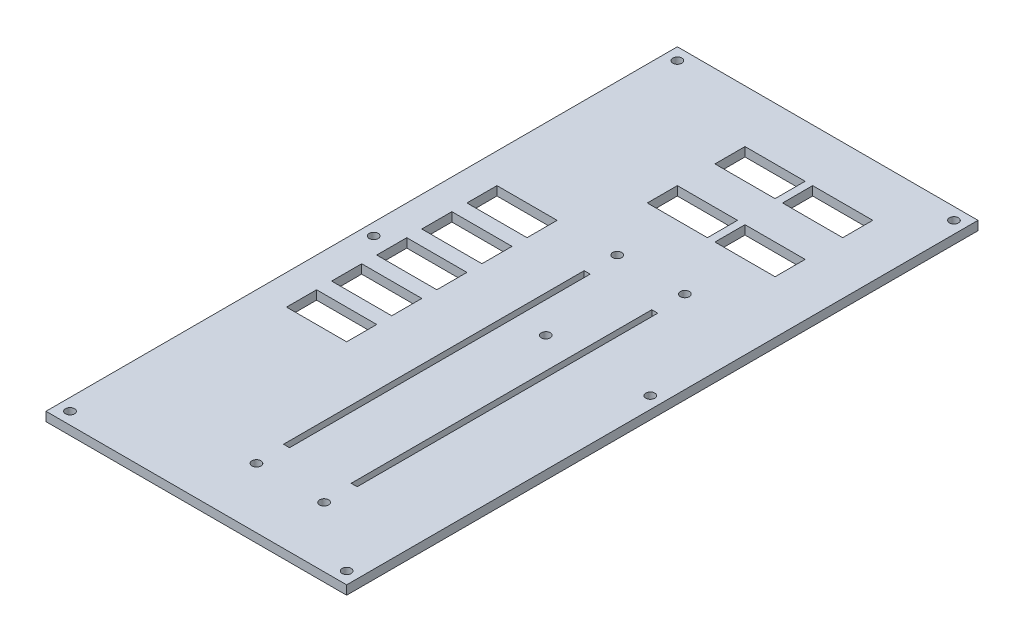
from build123d import *

# Parameters (mm, degrees)
SKETCH1_W            = 100
SKETCH1_H            = 210
BOSS_EXTRUDE1_DEPTH  = 3
CUT_EXTRUDE1_REACH   = 118.336
SKETCH3_R            = 1.5
SKETCH3_W            = 2
SKETCH3_H            = 100
LPATTERN1_COUNT      = 2
LPATTERN1_PITCH      = 22.5
CUT_EXTRUDE2_REACH   = 118.336
SKETCH4_W            = 20
SKETCH4_H            = 10
LPATTERN2_COUNT      = 2
LPATTERN2_PITCH      = 22.5
LPATTERN2_COUNT_DIR2 = 2
LPATTERN2_PITCH_DIR2 = 22.5
CUT_EXTRUDE3_REACH   = 118.336
SKETCH5_R            = 1.5
CUT_EXTRUDE4_REACH   = 118.336
SKETCH6_W            = 20
SKETCH6_H            = 10
LPATTERN3_COUNT      = 5
LPATTERN3_PITCH      = 15
CUT_EXTRUDE5_REACH   = 118.336
SKETCH7_R            = 1.5
CUT_EXTRUDE6_REACH   = 118.336
SKETCH8_R            = 1.5


with BuildPart() as part:
    # Sketch1 → Boss-Extrude1 (new body)
    with BuildSketch(Plane(origin=(0, 0, 0), x_dir=(1, 0, 0), z_dir=(0, 1, 0))):
        Rectangle(SKETCH1_W, SKETCH1_H)
    extrude(amount=BOSS_EXTRUDE1_DEPTH)

    # Sketch3 → Cut-Extrude1 (cut, up to next)
    with BuildSketch(Plane(origin=(0, 3, 0), x_dir=(1, 0, 0), z_dir=(0, 1, 0)), mode=Mode.PRIVATE) as cut_extrude1_sk1:
        with Locations(Location((0, -85, 0), (0, 0, 270))):
            Circle(SKETCH3_R)
    cut_extrude1_tool1 = extrude(cut_extrude1_sk1.sketch, amount=-CUT_EXTRUDE1_REACH, mode=Mode.PRIVATE) & part.part
    # Sketch3 → Cut-Extrude1 (cut, up to next)
    with BuildSketch(Plane(origin=(0, 3, 0), x_dir=(1, 0, 0), z_dir=(0, 1, 0)), mode=Mode.PRIVATE) as cut_extrude1_sk2:
        with Locations(Location((0, 35, 0), (0, 0, 270))):
            Circle(SKETCH3_R)
    cut_extrude1_tool2 = extrude(cut_extrude1_sk2.sketch, amount=-CUT_EXTRUDE1_REACH, mode=Mode.PRIVATE) & part.part
    # Sketch3 → Cut-Extrude1 (cut, up to next)
    with BuildSketch(Plane(origin=(0, 3, 0), x_dir=(1, 0, 0), z_dir=(0, 1, 0)), mode=Mode.PRIVATE) as cut_extrude1_sk3:
        with Locations((0, -25)):
            Rectangle(SKETCH3_W, SKETCH3_H)
    cut_extrude1_tool3 = extrude(cut_extrude1_sk3.sketch, amount=-CUT_EXTRUDE1_REACH, mode=Mode.PRIVATE) & part.part
    cut_extrude1_1 = cut_extrude1_tool1.solids().sort_by_distance((0, 3, 85))[0]
    add(cut_extrude1_1, mode=Mode.SUBTRACT)
    cut_extrude1_2 = cut_extrude1_tool2.solids().sort_by_distance((0, 3, -35))[0]
    add(cut_extrude1_2, mode=Mode.SUBTRACT)
    cut_extrude1_3 = cut_extrude1_tool3.solids().sort_by_distance((0, 3, 25))[0]
    add(cut_extrude1_3, mode=Mode.SUBTRACT)
    cut_extrude1 = cut_extrude1_1 + cut_extrude1_2 + cut_extrude1_3  # Cut-Extrude1 as one shape, for the pattern or mirror that repeats it

    # LPattern1: Cut-Extrude1 ×2
    with Locations(*[(i * LPATTERN1_PITCH, 0, 0) for i in range(1, LPATTERN1_COUNT)]):
        add(cut_extrude1, mode=Mode.SUBTRACT)

    # Sketch4 → Cut-Extrude2 (cut, up to next)
    with BuildSketch(Plane(origin=(0, 3, 0), x_dir=(1, 0, 0), z_dir=(0, 1, 0)), mode=Mode.PRIVATE) as cut_extrude2_sk1:
        with Locations((0, 60)):
            Rectangle(SKETCH4_W, SKETCH4_H)
    cut_extrude2_tool1 = extrude(cut_extrude2_sk1.sketch, amount=-CUT_EXTRUDE2_REACH, mode=Mode.PRIVATE) & part.part
    cut_extrude2 = cut_extrude2_tool1.solids().sort_by_distance((0, 3, -60))[0]
    add(cut_extrude2, mode=Mode.SUBTRACT)

    # LPattern2: Cut-Extrude2 2 × 2
    with Locations(*[(i * LPATTERN2_PITCH, 0, -j * LPATTERN2_PITCH_DIR2) for i in range(LPATTERN2_COUNT) for j in range(LPATTERN2_COUNT_DIR2) if (i, j) != (0, 0)]):
        add(cut_extrude2, mode=Mode.SUBTRACT)

    # Sketch5 → Cut-Extrude3 (cut, up to next)
    with BuildSketch(Plane(origin=(0, 3, 0), x_dir=(1, 0, 0), z_dir=(0, 1, 0)), mode=Mode.PRIVATE) as cut_extrude3_sk1:
        with Locations(Location((-46, 101, 0), (0, 0, 270))):
            Circle(SKETCH5_R)
    cut_extrude3_tool1 = extrude(cut_extrude3_sk1.sketch, amount=-CUT_EXTRUDE3_REACH, mode=Mode.PRIVATE) & part.part
    # Sketch5 → Cut-Extrude3 (cut, up to next)
    with BuildSketch(Plane(origin=(0, 3, 0), x_dir=(1, 0, 0), z_dir=(0, 1, 0)), mode=Mode.PRIVATE) as cut_extrude3_sk2:
        with Locations(Location((46, 101, 0), (0, 0, 270))):
            Circle(SKETCH5_R)
    cut_extrude3_tool2 = extrude(cut_extrude3_sk2.sketch, amount=-CUT_EXTRUDE3_REACH, mode=Mode.PRIVATE) & part.part
    # Sketch5 → Cut-Extrude3 (cut, up to next)
    with BuildSketch(Plane(origin=(0, 3, 0), x_dir=(1, 0, 0), z_dir=(0, 1, 0)), mode=Mode.PRIVATE) as cut_extrude3_sk3:
        with Locations(Location((46, -101, 0), (0, 0, 270))):
            Circle(SKETCH5_R)
    cut_extrude3_tool3 = extrude(cut_extrude3_sk3.sketch, amount=-CUT_EXTRUDE3_REACH, mode=Mode.PRIVATE) & part.part
    # Sketch5 → Cut-Extrude3 (cut, up to next)
    with BuildSketch(Plane(origin=(0, 3, 0), x_dir=(1, 0, 0), z_dir=(0, 1, 0)), mode=Mode.PRIVATE) as cut_extrude3_sk4:
        with Locations(Location((-46, -101, 0), (0, 0, 270))):
            Circle(SKETCH5_R)
    cut_extrude3_tool4 = extrude(cut_extrude3_sk4.sketch, amount=-CUT_EXTRUDE3_REACH, mode=Mode.PRIVATE) & part.part
    # Sketch5 → Cut-Extrude3 (cut, up to next)
    with BuildSketch(Plane(origin=(0, 3, 0), x_dir=(1, 0, 0), z_dir=(0, 1, 0)), mode=Mode.PRIVATE) as cut_extrude3_sk5:
        with Locations(Location((11.25, 0, 0), (0, 0, 270))):
            Circle(SKETCH5_R)
    cut_extrude3_tool5 = extrude(cut_extrude3_sk5.sketch, amount=-CUT_EXTRUDE3_REACH, mode=Mode.PRIVATE) & part.part
    add(cut_extrude3_tool1.solids().sort_by_distance((-46, 3, -101))[0], mode=Mode.SUBTRACT)
    add(cut_extrude3_tool2.solids().sort_by_distance((46, 3, -101))[0], mode=Mode.SUBTRACT)
    add(cut_extrude3_tool3.solids().sort_by_distance((46, 3, 101))[0], mode=Mode.SUBTRACT)
    add(cut_extrude3_tool4.solids().sort_by_distance((-46, 3, 101))[0], mode=Mode.SUBTRACT)
    add(cut_extrude3_tool5.solids().sort_by_distance((11.25, 3, 0))[0], mode=Mode.SUBTRACT)

    # Sketch6 → Cut-Extrude4 (cut, up to next)
    with BuildSketch(Plane(origin=(0, 3, 0), x_dir=(1, 0, 0), z_dir=(0, 1, 0)), mode=Mode.PRIVATE) as cut_extrude4_sk1:
        with Locations((-30, 30)):
            Rectangle(SKETCH6_W, SKETCH6_H)
    cut_extrude4_tool1 = extrude(cut_extrude4_sk1.sketch, amount=-CUT_EXTRUDE4_REACH, mode=Mode.PRIVATE) & part.part
    cut_extrude4 = cut_extrude4_tool1.solids().sort_by_distance((-30, 3, -30))[0]
    add(cut_extrude4, mode=Mode.SUBTRACT)

    # LPattern3: Cut-Extrude4 ×5
    with Locations(*[(0, 0, i * LPATTERN3_PITCH) for i in range(1, LPATTERN3_COUNT)]):
        add(cut_extrude4, mode=Mode.SUBTRACT)

    # Sketch7 → Cut-Extrude5 (cut, up to next)
    with BuildSketch(Plane(origin=(0, 3, 0), x_dir=(1, 0, 0), z_dir=(0, 1, 0)), mode=Mode.PRIVATE) as cut_extrude5_sk1:
        with Locations(Location((-46, 0, 0), (0, 0, 270))):
            Circle(SKETCH7_R)
    cut_extrude5_tool1 = extrude(cut_extrude5_sk1.sketch, amount=-CUT_EXTRUDE5_REACH, mode=Mode.PRIVATE) & part.part
    add(cut_extrude5_tool1.solids().sort_by_distance((-46, 3, 0))[0], mode=Mode.SUBTRACT)

    # Sketch8 → Cut-Extrude6 (cut, up to next)
    with BuildSketch(Plane(origin=(0, 3, 0), x_dir=(1, 0, 0), z_dir=(0, 1, 0)), mode=Mode.PRIVATE) as cut_extrude6_sk1:
        with Locations(Location((46, 0, 0), (0, 0, 270))):
            Circle(SKETCH8_R)
    cut_extrude6_tool1 = extrude(cut_extrude6_sk1.sketch, amount=-CUT_EXTRUDE6_REACH, mode=Mode.PRIVATE) & part.part
    add(cut_extrude6_tool1.solids().sort_by_distance((46, 3, 0))[0], mode=Mode.SUBTRACT)


solid = part.part
